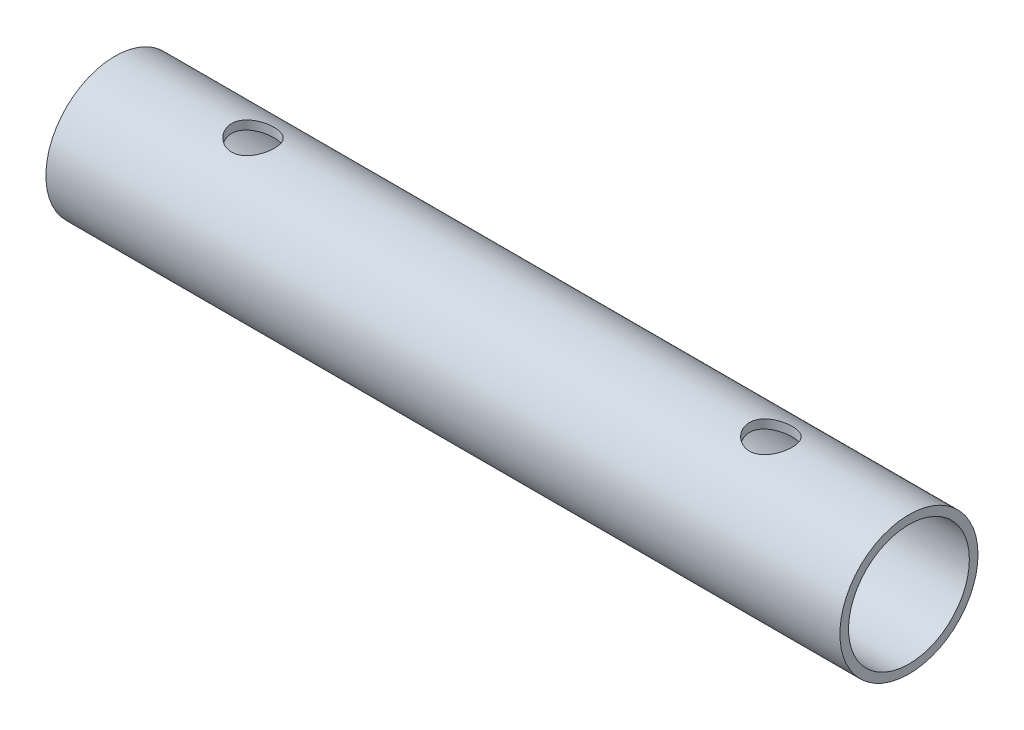
from build123d import *

# Parameters (mm, degrees)
SKETCH_1_R               = 10
SKETCH_1_R_2             = 8.75
EXTRUDE_1_DEPTH          = 115
CUT_EXTRUDE_1_DEPTH      = 116.866302263
CUT_EXTRUDE_1_DEPTH_BACK = 116.866302263
SKETCH_2_R               = 3.1


with BuildPart() as part:
    # 草图1 → 凸台-拉伸1 (new body)
    with BuildSketch(Plane(origin=(0, 0, 0), x_dir=(0, 0, -1), z_dir=(1, 0, 0))):
        Circle(SKETCH_1_R)
        Circle(SKETCH_1_R_2, mode=Mode.SUBTRACT)
    extrude(amount=EXTRUDE_1_DEPTH)

    # 草图2 → 切除-拉伸1 (cut, two sides: drawn at the far end of the back side and taken through both)
    with BuildSketch(Plane(origin=(0, 0, 0), x_dir=(1, 0, 0), z_dir=(0, 1, 0)).offset(-CUT_EXTRUDE_1_DEPTH_BACK)):
        with Locations(Location((20, 0, 0), (0, 0, 270))):
            Circle(SKETCH_2_R)
        with Locations(Location((95, 0, 0), (0, 0, 270))):
            Circle(SKETCH_2_R)
    extrude(amount=CUT_EXTRUDE_1_DEPTH + CUT_EXTRUDE_1_DEPTH_BACK, mode=Mode.SUBTRACT)


solid = part.part
